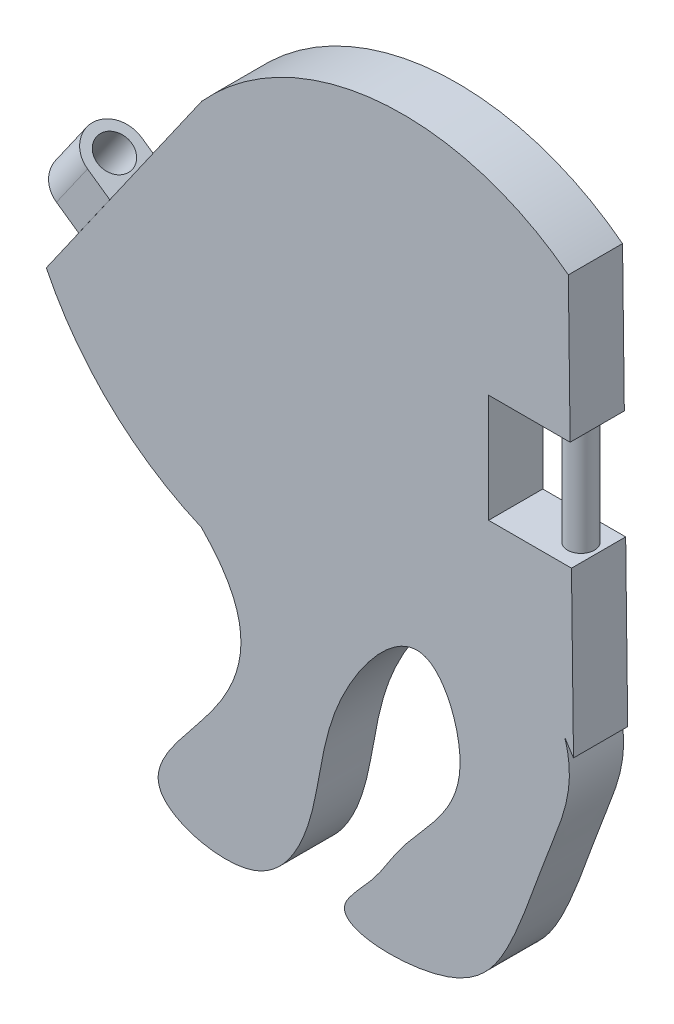
from build123d import *

# Parameters (mm, degrees)
SALIENTE_EXTRUIR1_DEPTH = 6
SALIENTE_EXTRUIR3_START = -50
SALIENTE_EXTRUIR3_DEPTH = 6
CROQUIS6_R              = 1.9
CORTAR_EXTRUIR1_DEPTH   = 6
CROQUIS7_W              = 10
CROQUIS7_H              = 12
CORTAR_EXTRUIR2_DEPTH   = 6
SALIENTE_EXTRUIR4_REACH = 85.469
CROQUIS8_R              = 1.5
CORTAR_EXTRUIR3_DEPTH   = 10
CORTAR_EXTRUIR4_DEPTH   = 10


with BuildPart() as part:
    # Croquis1 → Saliente-Extruir1 (new body)
    with BuildSketch(Plane.XY):
        with BuildLine():
            Line((-40.177079655, 40.873667183), (-57.384372746, 16.299105855))
            ThreePointArc((-57.384372746, 16.299105855), (-50.266363801, 6.607649625), (-40.220004181, 0))
            add(Edge.make_bspline(
                [(0, 0), (1.420390437, -4.299796122), (-1.907562696, -11.446603699), (-5.257292975, -22.105193397), (-10.841461249, -31.172967889), (-27.949808585, -30.8509285), (-20.743127863, -24.149828865), (-17.473659403, -17.841654314), (-9.062071908, -11.374092475), (-15.390918352, 5.224002499), (-27.772180986, -10.710774115), (-26.687137084, -21.670008033), (-33.871045739, -32.336486368), (-49.711449451, -28.323795663), (-35.274536828, -14.591782023), (-34.201611429, -6.058571535), (-40.220004181, 0)],
                knots=[0, 0, 0, 0, 0.077579821, 0.150368964, 0.212574392, 0.288439124, 0.319301659, 0.356974184, 0.436636001, 0.500260746, 0.583217266, 0.683911459, 0.736105655, 0.804521011, 0.878414066, 1, 1, 1, 1], degree=3))
            Line((0, 0), (1.583219784, -2.424605926))
            Line((1.583219784, -2.424605926), (1.583219784, 43.575394074))
            ThreePointArc((1.583219784, 43.575394074), (-19.845782505, 50.708085241), (-40.177079655, 40.873667183))
        make_face()
    extrude(amount=SALIENTE_EXTRUIR1_DEPTH)

    # Croquis7 → Cortar-Extruir2 (cut)
    with BuildSketch(Plane.XY.offset(6)):
        with Locations((-3.416780216, 22.575394074)):
            Rectangle(CROQUIS7_W, CROQUIS7_H)
    extrude(amount=-CORTAR_EXTRUIR2_DEPTH, mode=Mode.SUBTRACT)

    # Croquis8 → Saliente-Extruir4 (add, up to next)
    with BuildSketch(Plane.XZ.offset(-28.575394074), mode=Mode.PRIVATE) as saliente_extruir4_sk1:
        with Locations(Location((-1.184379483, 3, 0), (0, 0, 90))):
            Circle(CROQUIS8_R)
    saliente_extruir4_tool1 = extrude(saliente_extruir4_sk1.sketch, amount=SALIENTE_EXTRUIR4_REACH, mode=Mode.PRIVATE) - part.part
    add(saliente_extruir4_tool1.solids().sort_by_distance((-1.184379, 28.575394, 3))[0])

    # Croquis9 → Cortar-Extruir3 (cut)
    with BuildSketch(Plane.XY.offset(6)):
        Polygon((1.813025197, -4.016825326), (0.194805228, 52.179540842), (3.764362793, 52.179540842), (5.382582761, -4.016825326), align=None)
    extrude(amount=-CORTAR_EXTRUIR3_DEPTH, mode=Mode.SUBTRACT)

    # Croquis10 → Cortar-Extruir4 (cut)
    with BuildSketch(Plane.XY.offset(6)):
        Polygon((0.415250858, 44.524065342), (1.014719114, -3.866057018), (7.923284132, -3.866057018), (7.923284132, 44.524065342), align=None)
    extrude(amount=-CORTAR_EXTRUIR4_DEPTH, mode=Mode.SUBTRACT)


with BuildPart() as body_2:
    # Croquis4 → Saliente-Extruir3 (new body)
    with BuildSketch(Plane(origin=(21.074452831, 30.097437803, 0), x_dir=(0.8191520442889889, -0.5735764363510503, 0), z_dir=(0.5735764363510503, 0.8191520442889889, 0)).offset(SALIENTE_EXTRUIR3_START)):
        with BuildLine():
            Line((-59.355309297, -6.033739666), (-56.355309297, -6.033739666))
            Line((-56.355309297, -6.033739666), (-56.355309297, -0.033739666))
            Line((-56.355309297, -0.033739666), (-59.355309297, -0.033739666))
            ThreePointArc((-59.355309297, -0.033739666), (-62.355309297, -3.033739666), (-59.355309297, -6.033739666))
        make_face()
    extrude(amount=SALIENTE_EXTRUIR3_DEPTH)

    # Croquis6 → Cortar-Extruir1 (cut)
    with BuildSketch(Plane(origin=(-4.162910369, -5.945252145, 0), x_dir=(0.8191520442889889, -0.5735764363510503, 0), z_dir=(0.5735764363510503, 0.8191520442889889, 0))):
        with Locations(Location((-59.382828679, -3.033739666, 0), (0, 0, 180))):
            Circle(CROQUIS6_R)
    extrude(amount=-CORTAR_EXTRUIR1_DEPTH, mode=Mode.SUBTRACT)


solid = Compound([part.part, body_2.part])
